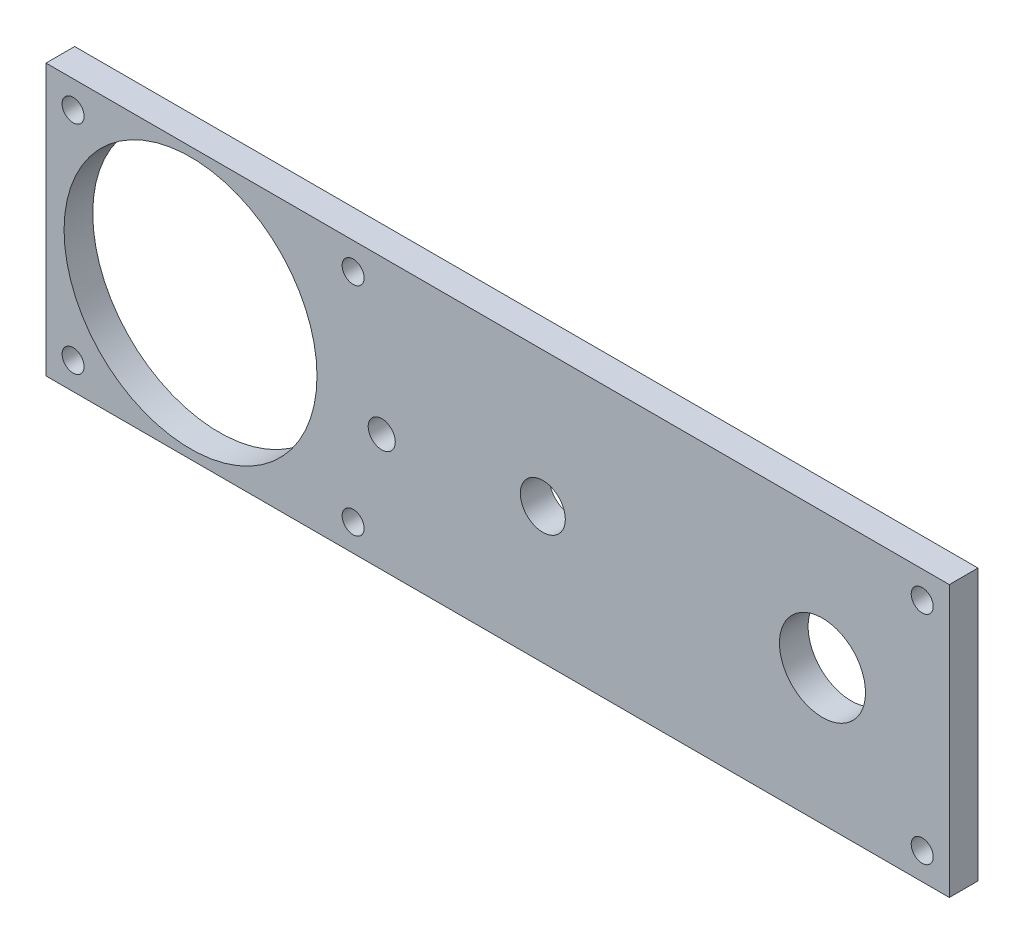
from build123d import *

# Parameters (mm, degrees)
SKETCH1_W             = 100
SKETCH1_H             = 30
SKETCH1_R             = 2.4892
SKETCH1_R_2           = 1.4986
SKETCH1_R_3           = 14
BOSS_EXTRUDE2_DEPTH   = 3.175
F_2_CLEARANCE_HOLE1_D = 2.4384
SKETCH5_R             = 4.7625
CUT_EXTRUDE1_DEPTH    = 105.45133137


with BuildPart() as part:
    # Sketch1 → Boss-Extrude2 (new body)
    with BuildSketch(Plane.XY):
        with Locations((50, 15)):
            Rectangle(SKETCH1_W, SKETCH1_H)
        with Locations((55, 15)):
            Circle(SKETCH1_R, mode=Mode.SUBTRACT)
        with Locations((37.166699296, 13)):
            Circle(SKETCH1_R_2, mode=Mode.SUBTRACT)
        with Locations((16, 15)):
            Circle(SKETCH1_R_3, mode=Mode.SUBTRACT)
    extrude(amount=BOSS_EXTRUDE2_DEPTH)

    # #2 Clearance Hole1 (through all)
    with Locations(Plane.XY.offset(3.175)):
        with Locations((97, 3), (97, 27), (3, 27), (3, 3), (34, 27), (34, 3)):
            Hole(F_2_CLEARANCE_HOLE1_D / 2)

    # Sketch5 → Cut-Extrude1 (cut, through all)
    with BuildSketch(Plane.XY.offset(3.175)):
        with Locations((85.9562, 15)):
            Circle(SKETCH5_R)
    extrude(amount=-CUT_EXTRUDE1_DEPTH, mode=Mode.SUBTRACT)


solid = part.part
